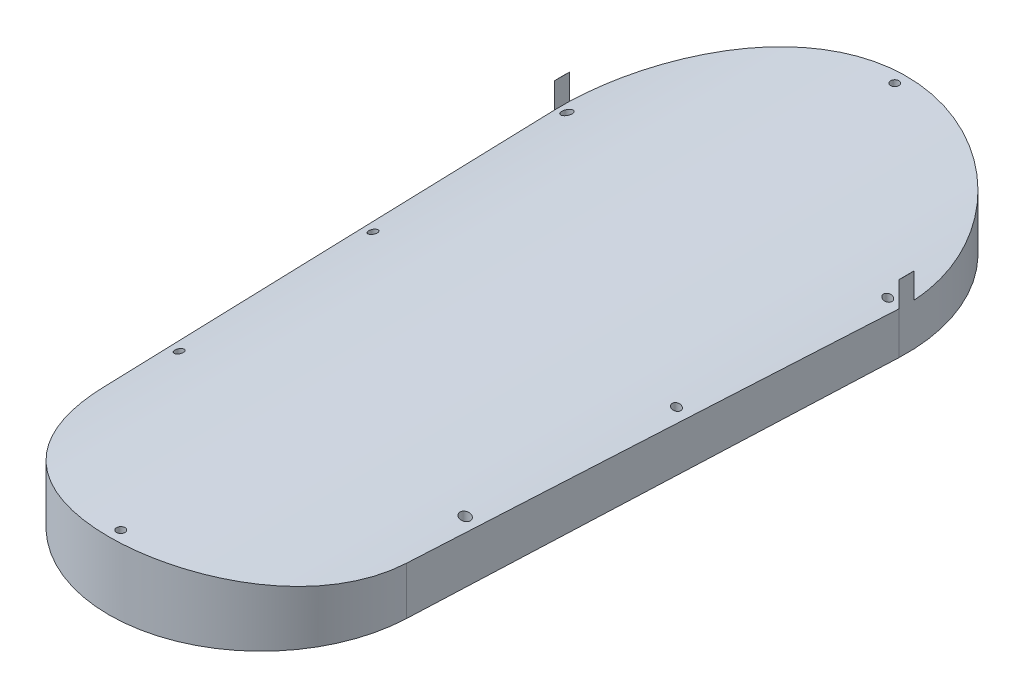
from build123d import *
from build123d.topology import SkipClean

# Parameters (mm, degrees)
SKETCH1_R               = 2.5
SKETCH1_R_2             = 3.025
BOSS_EXTRUDE1_DEPTH     = 10
BOSS_EXTRUDE2_START     = 10
SKETCH1_3_R             = 2.5
SKETCH1_3_R_2           = 3.025
BOSS_EXTRUDE2_DEPTH     = 30
CUT_EXTRUDE1_DEPTH      = 261.765043932
CUT_EXTRUDE1_DEPTH_BACK = 261.765043932


with BuildPart() as part:
    # Sketch1 → Boss-Extrude1 (new body)
    with BuildSketch(Plane(origin=(0, 0, 0), x_dir=(1, 0, 0), z_dir=(0, 1, 0))):
        with BuildLine():
            ThreePointArc((-89.657665168, -149.337855292), (0.259643783, -235.480712435), (90.176952733, -149.337855292))
            Line((90.176952733, -149.337855292), (102.16592726, 130.147858994))
            ThreePointArc((102.16592726, 130.147858994), (0.259643783, 236.519287565), (-101.646639695, 130.147858994))
            Line((-101.646639695, 130.147858994), (-89.657665168, -149.337855292))
        make_face()
        with Locations((0.259643783, -228.480712435)):
            Circle(SKETCH1_R, mode=Mode.SUBTRACT)
        with Locations((-84.367356936, -109.331631542)):
            Circle(SKETCH1_R, mode=Mode.SUBTRACT)
        with Locations((84.886644501, -109.331631542)):
            Circle(SKETCH1_R_2, mode=Mode.SUBTRACT)
        with Locations((-89.510214078, 10.558113726)):
            Circle(SKETCH1_R, mode=Mode.SUBTRACT)
        with Locations((-94.653071221, 130.447858994)):
            Circle(SKETCH1_R_2, mode=Mode.SUBTRACT)
        with BuildLine():
            Line((-89.00538555, 22.122937467), (-93.159737328, 118.968749538))
            ThreePointArc((-93.159737328, 118.968749538), (-92.545843606, 121.591841947), (-90.660000485, 123.515659768))
            ThreePointArc((-90.660000485, 123.515659768), (-86.653647828, 130.543907811), (-90.827597046, 137.473935234))
            ThreePointArc((-90.827597046, 137.473935234), (-92.837020914, 139.491004193), (-93.419614983, 142.277926441))
            ThreePointArc((-93.419614983, 142.277926441), (-67.617766725, 199.547413348), (-11.506691914, 227.779961722))
            ThreePointArc((-11.506691914, 227.779961722), (-8.697361943, 227.31734246), (-6.59602808, 225.396210642))
            ThreePointArc((-6.59602808, 225.396210642), (0.259643783, 221.519287565), (7.115315645, 225.396210642))
            ThreePointArc((7.115315645, 225.396210642), (9.216649508, 227.31734246), (12.025979479, 227.779961722))
            ThreePointArc((12.025979479, 227.779961722), (68.13705429, 199.547413348), (93.938902548, 142.277926441))
            ThreePointArc((93.938902548, 142.277926441), (93.356308479, 139.491004193), (91.346884611, 137.473935234))
            ThreePointArc((91.346884611, 137.473935234), (87.172935393, 130.543907811), (91.17928805, 123.515659768))
            ThreePointArc((91.17928805, 123.515659768), (93.065131171, 121.591841947), (93.679024893, 118.968749538))
            Line((93.679024893, 118.968749538), (91.627693163, 71.148319825))
            Line((91.627693163, 71.148319825), (89.524673116, 22.122937467))
            ThreePointArc((89.524673116, 22.122937467), (88.688404599, 19.562052023), (86.644741901, 17.806796467))
            ThreePointArc((86.644741901, 17.806796467), (82.036851959, 10.900970869), (86.036430907, 3.625914501))
            ThreePointArc((86.036430907, 3.625914501), (87.922274029, 1.702096679), (88.53616775, -0.920995729))
            Line((88.53616775, -0.920995729), (84.381815973, -97.766807801))
            ThreePointArc((84.381815973, -97.766807801), (83.545547456, -100.327693245), (81.501884759, -102.082948801))
            ThreePointArc((81.501884759, -102.082948801), (76.893994816, -108.988774399), (80.893573765, -116.263830767))
            ThreePointArc((80.893573765, -116.263830767), (82.779416886, -118.187648589), (83.393310607, -120.810740997))
            Line((83.393310607, -120.810740997), (82.184303049, -148.994998149))
            ThreePointArc((82.184303049, -148.994998149), (61.109482621, -200.447039521), (12.058029185, -226.627481329))
            ThreePointArc((12.058029185, -226.627481329), (9.218317346, -226.207678989), (7.077472495, -224.295355623))
            ThreePointArc((7.077472495, -224.295355623), (0.259643783, -220.480712435), (-6.55818493, -224.295355623))
            ThreePointArc((-6.55818493, -224.295355623), (-8.699029781, -226.207678989), (-11.53874162, -226.627481329))
            ThreePointArc((-11.53874162, -226.627481329), (-60.590195056, -200.447039521), (-81.665015484, -148.994998149))
            Line((-81.665015484, -148.994998149), (-82.874023042, -120.810740997))
            ThreePointArc((-82.874023042, -120.810740997), (-82.260129321, -118.187648589), (-80.3742862, -116.263830767))
            ThreePointArc((-80.3742862, -116.263830767), (-76.374707251, -108.988774399), (-80.982597194, -102.082948801))
            ThreePointArc((-80.982597194, -102.082948801), (-83.026259891, -100.327693245), (-83.862528408, -97.766807801))
            Line((-83.862528408, -97.766807801), (-86.67600341, -32.179374194))
            Line((-86.67600341, -32.179374194), (-87.181946752, -20.384876194))
            Line((-87.181946752, -20.384876194), (-88.016880185, -0.920995729))
            ThreePointArc((-88.016880185, -0.920995729), (-87.402986464, 1.702096679), (-85.517143342, 3.625914501))
            ThreePointArc((-85.517143342, 3.625914501), (-81.517564394, 10.900970869), (-86.125454336, 17.806796467))
            ThreePointArc((-86.125454336, 17.806796467), (-88.169117034, 19.562052023), (-89.00538555, 22.122937467))
        make_face(mode=Mode.SUBTRACT)
        with Locations((90.029501643, 10.558113726)):
            Circle(SKETCH1_R, mode=Mode.SUBTRACT)
        with Locations((0.259643783, 229.519287565)):
            Circle(SKETCH1_R, mode=Mode.SUBTRACT)
        with Locations((95.172358786, 130.447858994)):
            Circle(SKETCH1_R, mode=Mode.SUBTRACT)
    extrude(amount=BOSS_EXTRUDE1_DEPTH)

    # Sketch1<3> → Boss-Extrude2 (add)
    with BuildSketch(Plane(origin=(0, 0, 0), x_dir=(1, 0, 0), z_dir=(0, 1, 0)).offset(BOSS_EXTRUDE2_START)):
        with BuildLine():
            ThreePointArc((-89.657665168, -149.337855292), (0.259643783, -235.480712435), (90.176952733, -149.337855292))
            Line((90.176952733, -149.337855292), (102.16592726, 130.147858994))
            ThreePointArc((102.16592726, 130.147858994), (0.259643783, 236.519287565), (-101.646639695, 130.147858994))
            Line((-101.646639695, 130.147858994), (-89.657665168, -149.337855292))
        make_face()
        with Locations((0.259643783, -228.480712435)):
            Circle(SKETCH1_3_R, mode=Mode.SUBTRACT)
        with Locations((-84.367356936, -109.331631542)):
            Circle(SKETCH1_3_R, mode=Mode.SUBTRACT)
        with Locations((84.886644501, -109.331631542)):
            Circle(SKETCH1_3_R_2, mode=Mode.SUBTRACT)
        with Locations((-89.510214078, 10.558113726)):
            Circle(SKETCH1_3_R, mode=Mode.SUBTRACT)
        with Locations((-94.653071221, 130.447858994)):
            Circle(SKETCH1_3_R_2, mode=Mode.SUBTRACT)
        with Locations((90.029501643, 10.558113726)):
            Circle(SKETCH1_3_R, mode=Mode.SUBTRACT)
        with Locations((0.259643783, 229.519287565)):
            Circle(SKETCH1_3_R, mode=Mode.SUBTRACT)
        with Locations((95.172358786, 130.447858994)):
            Circle(SKETCH1_3_R, mode=Mode.SUBTRACT)
    extrude(amount=BOSS_EXTRUDE2_DEPTH)

    # Sketch2 → Cut-Extrude1 (cut, two sides: drawn at the far end of the back side and taken through both)
    with SkipClean():  # the faces are left unmerged after this step: merging them gives an invalid solid
        with BuildSketch(Plane.XY.offset(-CUT_EXTRUDE1_DEPTH_BACK)):
            with BuildLine():
                Line((102.16592726, 40), (0.259643782, 40))
                ThreePointArc((0.259643782, 40), (51.761805417, 36.229905144), (102.16592726, 25))
                Line((102.16592726, 25), (102.16592726, 40))
            make_face()
            with BuildLine():
                Line((-101.646639695, 40), (-101.646639695, 25))
                ThreePointArc((-101.646639695, 25), (-51.242517852, 36.229905144), (0.259643782, 40))
                Line((0.259643782, 40), (-101.646639695, 40))
            make_face()
        extrude(amount=CUT_EXTRUDE1_DEPTH + CUT_EXTRUDE1_DEPTH_BACK, mode=Mode.SUBTRACT)


solid = part.part
